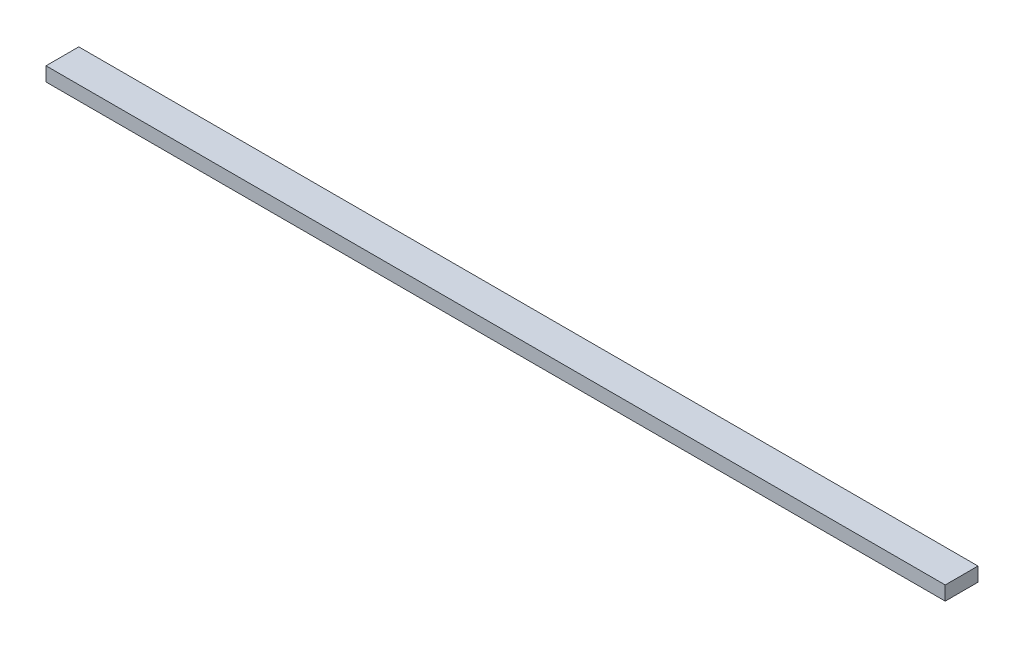
from build123d import *

# Parameters (mm, degrees)
SKETCH1_W           = 88.9
SKETCH1_H           = 38.1
BOSS_EXTRUDE1_DEPTH = 2438.4


with BuildPart() as part:
    # Sketch1 → Boss-Extrude1 (new body)
    with BuildSketch(Plane(origin=(0, 0, 0), x_dir=(0, 0, -1), z_dir=(1, 0, 0))):
        with Locations((44.45, 19.05)):
            Rectangle(SKETCH1_W, SKETCH1_H)
    extrude(amount=BOSS_EXTRUDE1_DEPTH)


solid = part.part
